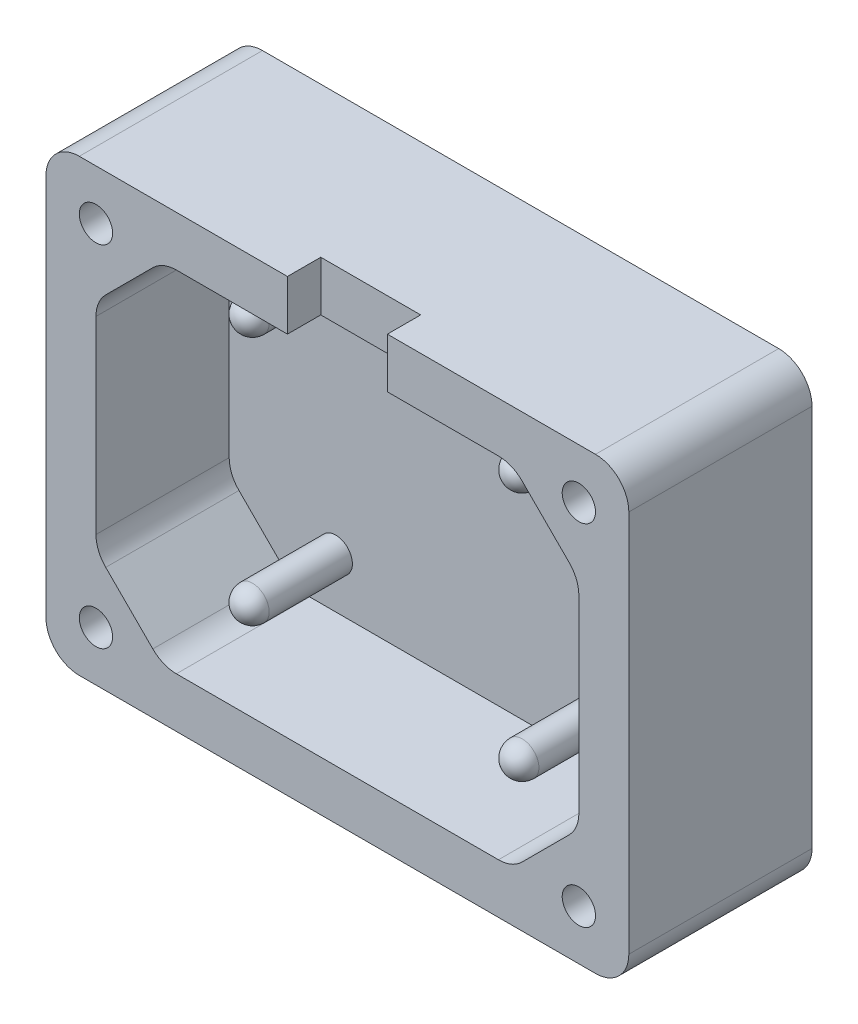
from build123d import *

# Parameters (mm, degrees)
ESQUISSE1_W             = 35
ESQUISSE1_H             = 27
BOSS_EXTRU_1_DEPTH      = 11
ESQUISSE2_W             = 29
ESQUISSE2_H             = 21
ENL_V_MAT_EXTRU_1_DEPTH = 8
CHANFREIN1_SIZE         = 4
ESQUISSE3_R             = 1
ENL_V_MAT_EXTRU_2_DEPTH = 7
ESQUISSE4_R             = 1
BOSS_EXTRU_2_DEPTH      = 6
CONG_2_R                = 1
CONG_3_R                = 2
CONG_4_R                = 2
ESQUISSE5_W             = 6
ESQUISSE5_H             = 3
ENL_V_MAT_EXTRU_3_DEPTH = 2


with BuildPart() as part:
    # Esquisse1 → Boss.-Extru.1 (new body)
    with BuildSketch(Plane.XY):
        Rectangle(ESQUISSE1_W, ESQUISSE1_H)
    extrude(amount=BOSS_EXTRU_1_DEPTH)

    # Esquisse2 → Enlèv. mat.-Extru.1 (cut)
    with BuildSketch(Plane.XY.offset(11)):
        Rectangle(ESQUISSE2_W, ESQUISSE2_H)
    extrude(amount=-ENL_V_MAT_EXTRU_1_DEPTH, mode=Mode.SUBTRACT)

    # Chanfrein1
    chanfrein1_edges = [part.edges().sort_by_distance(p)[0] for p in [
        (-14.5, 10.5, 7),
        (-14.5, -10.5, 7),
        (14.5, -10.5, 7),
        (14.5, 10.5, 7),
    ]]
    chamfer(chanfrein1_edges, length=CHANFREIN1_SIZE)

    # Esquisse3 → Enlèv. mat.-Extru.2 (cut)
    with BuildSketch(Plane.XY.offset(11)):
        with Locations((-14.5, 10.5)):
            Circle(ESQUISSE3_R)
        with Locations((14.5, 10.5)):
            Circle(ESQUISSE3_R)
        with Locations((14.5, -10.5)):
            Circle(ESQUISSE3_R)
        with Locations((-14.5, -10.5)):
            Circle(ESQUISSE3_R)
    extrude(amount=-ENL_V_MAT_EXTRU_2_DEPTH, mode=Mode.SUBTRACT)

    # Esquisse4 → Boss.-Extru.2 (add)
    with BuildSketch(Plane.XY.offset(3)):
        with Locations((-8.1, 7.5)):
            Circle(ESQUISSE4_R)
        with Locations((8.1, 7.5)):
            Circle(ESQUISSE4_R)
        with Locations((-8.1, -7.5)):
            Circle(ESQUISSE4_R)
        with Locations((8.1, -7.5)):
            Circle(ESQUISSE4_R)
    extrude(amount=BOSS_EXTRU_2_DEPTH)

    # Congé2
    cong_2_edges = [part.edges().sort_by_distance(p)[0] for p in [
        (-9.1, 7.5, 9),
        (7.1, 7.5, 9),
        (7.1, -7.5, 9),
        (-9.1, -7.5, 9),
    ]]
    fillet(cong_2_edges, radius=CONG_2_R)

    # Congé3
    cong_3_edges = [part.edges().sort_by_distance(p)[0] for p in [
        (-17.5, 13.5, 5.5),
        (-17.5, -13.5, 5.5),
        (17.5, 13.5, 5.5),
        (17.5, -13.5, 5.5),
    ]]
    fillet(cong_3_edges, radius=CONG_3_R)

    # Congé4
    cong_4_edges = [part.edges().sort_by_distance(p)[0] for p in [
        (14.5, -6.5, 7),
        (10.5, -10.5, 7),
        (14.5, 6.5, 7),
        (10.5, 10.5, 7),
        (-10.5, -10.5, 7),
        (-14.5, -6.5, 7),
        (-14.5, 6.5, 7),
        (-10.5, 10.5, 7),
    ]]
    fillet(cong_4_edges, radius=CONG_4_R)

    # Esquisse5 → Enlèv. mat.-Extru.3 (cut)
    with BuildSketch(Plane.XY.offset(11)):
        with Locations((0, 12)):
            Rectangle(ESQUISSE5_W, ESQUISSE5_H)
    extrude(amount=-ENL_V_MAT_EXTRU_3_DEPTH, mode=Mode.SUBTRACT)


solid = part.part
